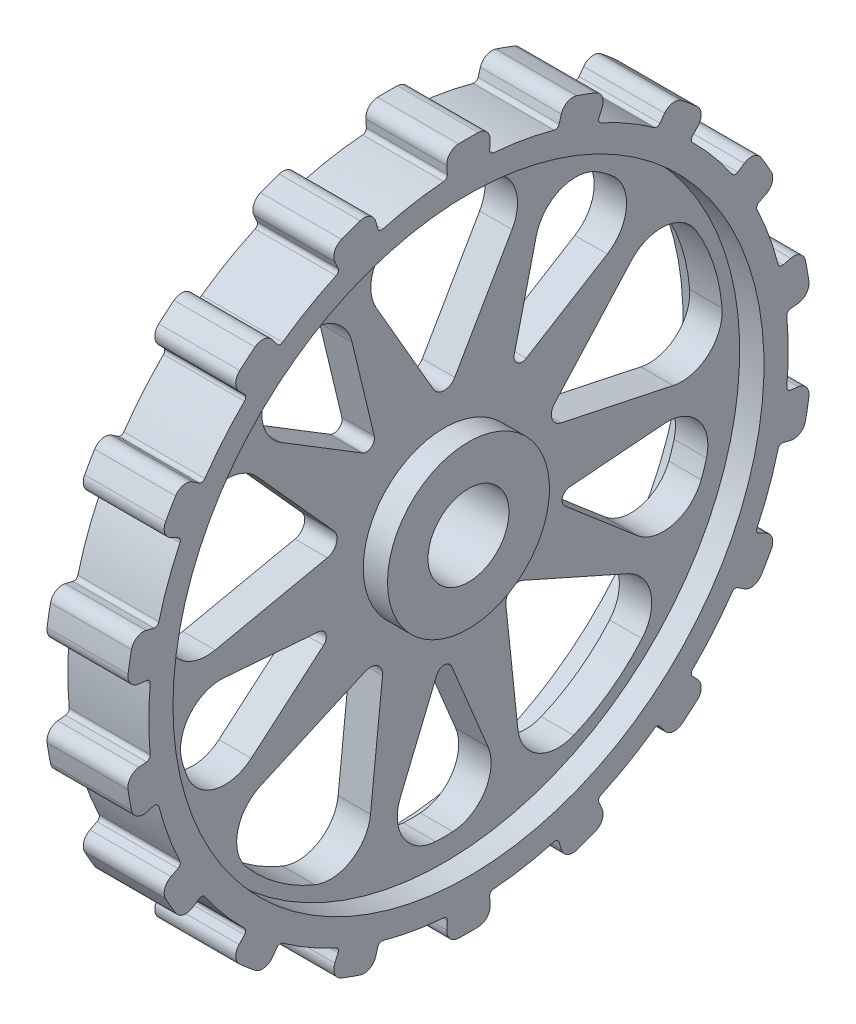
from build123d import *

# Parameters (mm, degrees)
SKETCH_9_W                       = 8
SKETCH_9_H                       = 45
CUT_REVOLVE_9_ANGLE              = 60
FILLET_1_R                       = 10
FILLET_2_R                       = 3
PATTERN_CIRCULAR_3_COUNT         = 5
FILLET_1_OF_PATTERN_CIRCULAR_3_R = 10
FILLET_2_OF_PATTERN_CIRCULAR_3_R = 3
SKETCH_10_W                      = 8
SKETCH_10_H                      = 40
CUT_REVOLVE_10_ANGLE             = 45
FILLET_3_R                       = 10
FILLET_4_R                       = 2
PATTERN_CIRCULAR_4_COUNT         = 5
FILLET_3_OF_PATTERN_CIRCULAR_4_R = 10
FILLET_4_OF_PATTERN_CIRCULAR_4_R = 2
SKETCH_12_W                      = 20
SKETCH_12_H                      = 6
CUT_REVOLVE_15_ANGLE             = 12.5
FILLET_5_R                       = 1
FILLET_6_R                       = 3
PATTERN_CIRCULAR_7_COUNT         = 18
FILLET_5_OF_PATTERN_CIRCULAR_7_R = 1
FILLET_6_OF_PATTERN_CIRCULAR_7_R = 3


with BuildPart() as part:
    # Эскиз1 → Повернуть1 (revolve)
    with BuildSketch(Plane.XY, mode=Mode.PRIVATE) as revolve_1_sk:
        Polygon((20, -73), (20, -85), (0, -85), (0, -73), (6, -73), (6, -20), (0, -20), (0, -10), (20, -10), (20, -20), (14, -20), (14, -73), align=None)
    revolve(revolve_1_sk.sketch.rotate(Axis((0, 0, 0), (1, 0, 0)), 270), axis=Axis((0, 0, 0), (1, 0, 0)))

    # Эскиз9 → Вырез-Повернуть9 (revolve, symmetric, cut)
    with BuildSketch(Plane.XY) as cut_revolve_9_sk:
        with Locations((10, 47.5)):
            Rectangle(SKETCH_9_W, SKETCH_9_H)
    cut_revolve_9 = revolve(axis=Axis((6, 25, 0), (1, 0, 0)), revolution_arc=CUT_REVOLVE_9_ANGLE / 2, mode=Mode.SUBTRACT)
    cut_revolve_9 = cut_revolve_9 + revolve(cut_revolve_9_sk.sketch, axis=Axis((6, 25, 0), (-1, 0, 0)), revolution_arc=CUT_REVOLVE_9_ANGLE / 2, mode=Mode.SUBTRACT)

    # Скругление1
    fillet_1_edges = [part.edges().sort_by_distance(p)[0] for p in [
        (10, 63.97114317, -22.5),
        (10, 63.97114317, 22.5),
    ]]
    fillet(fillet_1_edges, radius=FILLET_1_R)

    # Скругление2
    fillet_2_edges = [part.edges().sort_by_distance(p)[0] for p in [
        (10, 25, 0),
    ]]
    fillet(fillet_2_edges, radius=FILLET_2_R)

    # Круговой массив3: Вырез-Повернуть9 ×5 about axis
    pattern_circular_3_axis = Axis((0, 0, 0), (1, 0, 0))
    for i in range(1, PATTERN_CIRCULAR_3_COUNT):
        add(cut_revolve_9.rotate(pattern_circular_3_axis, i * 360 / PATTERN_CIRCULAR_3_COUNT), mode=Mode.SUBTRACT)

    # Скругление1 of Круговой массив3
    fillet_1_of_pattern_circular_3_edges = [part.edges().sort_by_distance(p)[0] for p in [
        (10, 41.166942006, 53.887290194),
        (10, -1.630601227, 67.79305494),
        (10, -38.528573798, 55.804176901),
        (10, -64.978910151, 19.398412154),
        (10, -64.978910151, -19.398412154),
        (10, -38.528573798, -55.804176901),
        (10, -1.630601227, -67.79305494),
        (10, 41.166942006, -53.887290194),
    ]]
    fillet(fillet_1_of_pattern_circular_3_edges, radius=FILLET_1_OF_PATTERN_CIRCULAR_3_R)

    # Скругление2 of Круговой массив3
    fillet_2_of_pattern_circular_3_edges = [part.edges().sort_by_distance(p)[0] for p in [
        (10, 7.725424859, 23.776412907),
        (10, -20.225424859, 14.694631307),
        (10, -20.225424859, -14.694631307),
        (10, 7.725424859, -23.776412907),
    ]]
    fillet(fillet_2_of_pattern_circular_3_edges, radius=FILLET_2_OF_PATTERN_CIRCULAR_3_R)

    # Эскиз10 → Вырез-Повернуть10 (revolve, symmetric, cut)
    with BuildSketch(Plane.XY) as cut_revolve_10_sk:
        with Locations((10, -47.5)):
            Rectangle(SKETCH_10_W, SKETCH_10_H)
    cut_revolve_10 = revolve(axis=Axis((6, -27.5, 0), (1, 0, 0)), revolution_arc=CUT_REVOLVE_10_ANGLE / 2, mode=Mode.SUBTRACT)
    cut_revolve_10 = cut_revolve_10 + revolve(cut_revolve_10_sk.sketch, axis=Axis((6, -27.5, 0), (-1, 0, 0)), revolution_arc=CUT_REVOLVE_10_ANGLE / 2, mode=Mode.SUBTRACT)

    # Скругление3
    fillet_3_edges = [part.edges().sort_by_distance(p)[0] for p in [
        (10, -64.4551813, -15.307337295),
        (10, -64.4551813, 15.307337295),
    ]]
    fillet(fillet_3_edges, radius=FILLET_3_R)

    # Скругление4
    fillet_4_edges = [part.edges().sort_by_distance(p)[0] for p in [
        (10, -27.5, 0),
    ]]
    fillet(fillet_4_edges, radius=FILLET_4_R)

    # Круговой массив4: Вырез-Повернуть10 ×5 about axis
    pattern_circular_4_axis = Axis((0, 0, 0), (1, 0, 0))
    for i in range(1, PATTERN_CIRCULAR_4_COUNT):
        add(cut_revolve_10.rotate(pattern_circular_4_axis, i * 360 / PATTERN_CIRCULAR_4_COUNT), mode=Mode.SUBTRACT)

    # Скругление3 of Круговой массив4
    fillet_3_of_pattern_circular_4_edges = [part.edges().sort_by_distance(p)[0] for p in [
        (10, -5.359603516, -66.030747547),
        (10, -34.475889279, -56.570292822),
        (10, 61.142764161, -25.501908992),
        (10, 43.147909934, -50.269701012),
        (10, 43.147909934, 50.269701012),
        (10, 61.142764161, 25.501908992),
        (10, -34.475889279, 56.570292822),
        (10, -5.359603516, 66.030747547),
    ]]
    fillet(fillet_3_of_pattern_circular_4_edges, radius=FILLET_3_OF_PATTERN_CIRCULAR_4_R)

    # Скругление4 of Круговой массив4
    fillet_4_of_pattern_circular_4_edges = [part.edges().sort_by_distance(p)[0] for p in [
        (10, -8.497967345, -26.154054198),
        (10, 22.247967345, -16.164094438),
        (10, 22.247967345, 16.164094438),
        (10, -8.497967345, 26.154054198),
    ]]
    fillet(fillet_4_of_pattern_circular_4_edges, radius=FILLET_4_OF_PATTERN_CIRCULAR_4_R)

    # Эскиз12 → Вырез-Повернуть15 (revolve, symmetric, cut)
    with BuildSketch(Plane(origin=(0, 0, 0), x_dir=(1, 0, 0), z_dir=(0, 1, 0))) as cut_revolve_15_sk:
        with Locations((10, -82)):
            Rectangle(SKETCH_12_W, SKETCH_12_H)
    cut_revolve_15 = revolve(axis=Axis((0, 0, 0), (1, 0, 0)), revolution_arc=CUT_REVOLVE_15_ANGLE / 2, mode=Mode.SUBTRACT)
    cut_revolve_15 = cut_revolve_15 + revolve(cut_revolve_15_sk.sketch, axis=Axis((0, 0, 0), (-1, 0, 0)), revolution_arc=CUT_REVOLVE_15_ANGLE / 2, mode=Mode.SUBTRACT)

    # Скругление5
    fillet_5_edges = [part.edges().sort_by_distance(p)[0] for p in [
        (10, 8.600483113, 78.53045072),
        (10, -8.600483113, 78.53045072),
    ]]
    fillet(fillet_5_edges, radius=FILLET_5_R)

    # Скругление6
    fillet_6_edges = [part.edges().sort_by_distance(p)[0] for p in [
        (10, -9.253684362, 84.494788749),
        (10, 9.253684362, 84.494788749),
    ]]
    fillet(fillet_6_edges, radius=FILLET_6_R)

    # Круговой массив7: Вырез-Повернуть15 ×18 about axis
    pattern_circular_7_axis = Axis((0, 0, 0), (1, 0, 0))
    for i in range(1, PATTERN_CIRCULAR_7_COUNT):
        add(cut_revolve_15.rotate(pattern_circular_7_axis, i * 360 / PATTERN_CIRCULAR_7_COUNT), mode=Mode.SUBTRACT)

    # Скругление5 of Круговой массив7
    fillet_5_of_pattern_circular_7_edges = [part.edges().sort_by_distance(p)[0] for p in [
        (10, -18.777185494, 76.736023515),
        (10, -34.940806527, 70.852946581),
        (10, -43.890048409, 65.686099372),
        (10, -57.066753003, 54.629531407),
        (10, -63.709123737, 46.713462221),
        (10, -72.30960685, 31.816988499),
        (10, -75.843938496, 22.106492108),
        (10, -78.830854936, 5.166847209),
        (10, -78.830854936, -5.166847209),
        (10, -75.843938496, -22.106492108),
        (10, -72.30960685, -31.816988499),
        (10, -63.709123737, -46.713462221),
        (10, -57.066753003, -54.629531407),
        (10, -43.890048409, -65.686099372),
        (10, -34.940806527, -70.852946581),
        (10, -18.777185494, -76.736023515),
        (10, -8.600483113, -78.53045072),
        (10, 8.600483113, -78.53045072),
        (10, 18.777185494, -76.736023515),
        (10, 34.940806527, -70.852946581),
        (10, 43.890048409, -65.686099372),
        (10, 57.066753003, -54.629531407),
        (10, 63.709123737, -46.713462221),
        (10, 72.30960685, -31.816988499),
        (10, 75.843938496, -22.106492108),
        (10, 78.830854936, -5.166847209),
        (10, 78.830854936, 5.166847209),
        (10, 75.843938496, 22.106492108),
        (10, 72.30960685, 31.816988499),
        (10, 63.709123737, 46.713462221),
        (10, 57.066753003, 54.629531407),
        (10, 43.890048409, 65.686099372),
        (10, 34.940806527, 70.852946581),
        (10, 18.777185494, 76.736023515),
    ]]
    fillet(fillet_5_of_pattern_circular_7_edges, radius=FILLET_5_OF_PATTERN_CIRCULAR_7_R)

    # Скругление6 of Круговой массив7
    fillet_6_of_pattern_circular_7_edges = [part.edges().sort_by_distance(p)[0] for p in [
        (10, -37.594538669, 76.23418303),
        (10, -20.203300848, 82.564075934),
        (10, -61.400936775, 58.778609741),
        (10, -47.223469807, 70.674917046),
        (10, -77.801475725, 34.233468638),
        (10, -68.547791363, 50.261320111),
        (10, -84.818008475, 5.559265985),
        (10, -81.604237623, 23.785466193),
        (10, -81.604237623, -23.785466193),
        (10, -84.818008475, -5.559265985),
        (10, -68.547791363, -50.261320111),
        (10, -77.801475725, -34.233468638),
        (10, -47.223469807, -70.674917046),
        (10, -61.400936775, -58.778609741),
        (10, -20.203300848, -82.564075934),
        (10, -37.594538669, -76.23418303),
        (10, 9.253684362, -84.494788749),
        (10, -9.253684362, -84.494788749),
        (10, 37.594538669, -76.23418303),
        (10, 20.203300848, -82.564075934),
        (10, 61.400936775, -58.778609741),
        (10, 47.223469807, -70.674917046),
        (10, 77.801475725, -34.233468638),
        (10, 68.547791363, -50.261320111),
        (10, 84.818008475, -5.559265985),
        (10, 81.604237623, -23.785466193),
        (10, 81.604237623, 23.785466193),
        (10, 84.818008475, 5.559265985),
        (10, 68.547791363, 50.261320111),
        (10, 77.801475725, 34.233468638),
        (10, 47.223469807, 70.674917046),
        (10, 61.400936775, 58.778609741),
        (10, 20.203300848, 82.564075934),
        (10, 37.594538669, 76.23418303),
    ]]
    fillet(fillet_6_of_pattern_circular_7_edges, radius=FILLET_6_OF_PATTERN_CIRCULAR_7_R)


solid = part.part
